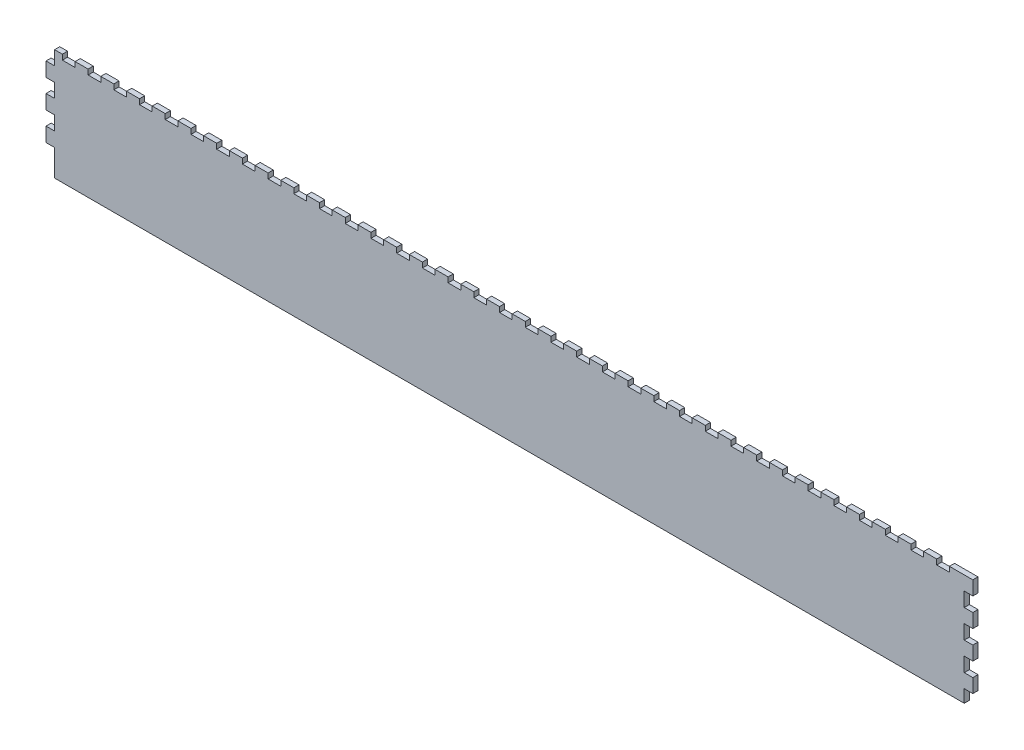
from build123d import *

# Parameters (mm, degrees)
BOSS_EXTRUDE1_DEPTH = 3


with BuildPart() as part:
    # Sketch1 → Boss-Extrude1 (new body)
    with BuildSketch(Plane.XY):
        Polygon((4.999668, 15.394029), (4.999668, 0), (533.359842, 0), (533.359842, 7.361228), (538.359861, 7.361228), (538.359861, 15.420913), (533.359842, 15.420913), (533.359842, 23.726716), (538.359861, 23.726716), (538.359861, 31.786399), (533.359842, 31.786399), (533.359842, 40.075658), (538.359861, 40.075658), (538.359861, 48.164934), (533.359842, 48.164934), (533.359842, 56.454193), (538.359861, 56.454193), (538.359861, 64.599998), (524.741368, 64.599998), (524.741368, 61.599976), (517.372941, 61.599976), (517.372941, 64.599998), (509.804503, 64.599998), (509.804503, 61.599976), (502.43602, 61.599976), (502.43602, 64.599998), (494.86761, 64.599998), (494.86761, 61.599976), (487.499126, 61.599976), (487.499126, 64.599998), (479.93066, 64.599998), (479.93066, 61.599976), (472.562233, 61.599976), (472.562233, 64.599998), (464.993767, 64.599998), (464.993767, 61.599976), (457.62534, 61.599976), (457.62534, 64.599998), (450.056704, 64.599998), (450.056704, 61.599976), (442.688587, 61.599976), (442.688587, 64.599998), (435.120093, 64.599998), (435.120093, 61.599976), (427.751638, 61.599976), (427.751638, 64.599998), (420.183143, 64.599998), (420.183143, 61.599976), (412.81466, 61.599976), (412.81466, 64.599998), (405.246165, 64.599998), (405.246165, 61.599976), (397.87771, 61.599976), (397.87771, 64.599998), (390.309215, 64.599998), (390.309215, 61.599976), (382.940732, 61.599976), (382.940732, 64.599998), (375.372237, 64.599998), (375.372237, 61.599976), (368.003782, 61.599976), (368.003782, 64.599998), (360.435626, 64.599998), (360.435626, 61.599976), (353.067171, 61.599976), (353.067171, 64.599998), (345.498648, 64.599998), (345.498648, 61.599976), (338.130193, 61.599976), (338.130193, 64.599998), (330.561699, 64.599998), (330.561699, 61.599976), (323.193243, 61.599976), (323.193243, 64.599998), (315.624721, 64.599998), (315.624721, 61.599976), (308.256265, 61.599976), (308.256265, 64.599998), (300.687771, 64.599998), (300.687771, 61.599976), (293.319315, 61.599976), (293.319315, 64.599998), (285.750793, 64.599998), (285.750793, 61.599976), (278.382337, 61.599976), (278.382337, 64.599998), (270.814182, 64.599998), (270.814182, 61.599976), (263.445726, 61.599976), (263.445726, 64.599998), (255.877232, 64.599998), (255.877232, 61.599976), (248.508777, 61.599976), (248.508748, 64.599998), (240.940282, 64.599998), (240.940282, 61.599976), (233.571799, 61.599976), (233.571799, 64.599998), (226.003304, 64.599998), (226.003304, 61.599976), (218.634849, 61.599976), (218.634821, 64.599998), (211.066354, 64.599998), (211.066354, 61.599976), (203.697871, 61.599976), (203.697871, 64.599998), (196.129743, 64.599998), (196.129743, 61.599976), (188.76126, 61.599976), (188.76126, 64.599998), (181.192765, 64.599998), (181.192765, 61.599976), (173.82431, 61.599976), (173.82431, 64.599998), (166.255815, 64.599998), (166.255815, 61.599976), (158.887332, 61.599976), (158.887332, 64.599998), (151.318837, 64.599998), (151.318837, 61.599976), (143.950382, 61.599976), (143.950382, 64.599998), (136.381859, 64.599998), (136.381859, 61.599976), (129.013404, 61.599976), (129.013404, 64.599998), (121.44491, 64.599998), (121.44491, 61.599976), (114.07644, 61.599976), (114.07644, 64.599998), (106.508299, 64.599998), (106.508299, 61.599976), (99.139829, 61.599976), (99.139829, 64.599998), (91.571335, 64.599998), (91.571335, 61.599976), (84.202865, 61.599976), (84.202865, 64.599998), (76.634371, 64.599998), (76.634371, 61.599976), (69.265901, 61.599976), (69.265901, 64.599998), (61.697407, 64.599998), (61.697407, 61.599976), (54.328937, 61.599976), (54.328937, 64.599998), (46.760443, 64.599998), (46.760443, 61.599976), (39.391974, 61.599976), (39.391974, 64.599998), (31.823479, 64.599998), (31.823479, 61.599976), (24.455362, 61.599976), (24.455362, 64.599998), (16.886868, 64.599998), (16.886868, 61.599976), (9.518399, 61.599976), (9.518399, 64.599998), (4.999668, 64.599998), (4.999668, 56.45419), (0, 56.45419), (0, 48.164931), (4.999668, 48.164931), (4.999668, 40.075652), (0, 40.075652), (0, 31.786393), (4.999668, 31.786393), (4.999668, 23.683291), (0, 23.683291), (0, 15.394029), align=None)
    extrude(amount=BOSS_EXTRUDE1_DEPTH)


solid = part.part
